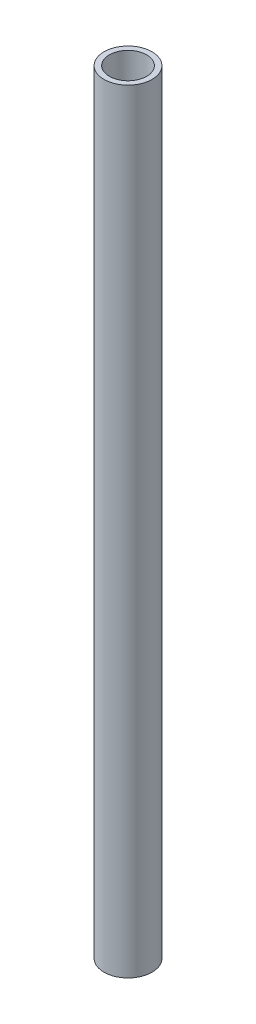
from build123d import *

# Parameters (mm, degrees)
SKETCH1_R           = 114.3
SKETCH1_R_2         = 88.9
BOSS_EXTRUDE1_DEPTH = 3683


with BuildPart() as part:
    # Sketch1 → Boss-Extrude1 (new body)
    with BuildSketch(Plane(origin=(0, 0, 0), x_dir=(1, 0, 0), z_dir=(0, 1, 0))):
        with Locations(Location((0, 0, 0), (0, 0, 90))):
            Circle(SKETCH1_R)
        with Locations(Location((0, 0, 0), (0, 0, 90))):
            Circle(SKETCH1_R_2, mode=Mode.SUBTRACT)
    extrude(amount=BOSS_EXTRUDE1_DEPTH)


solid = part.part
